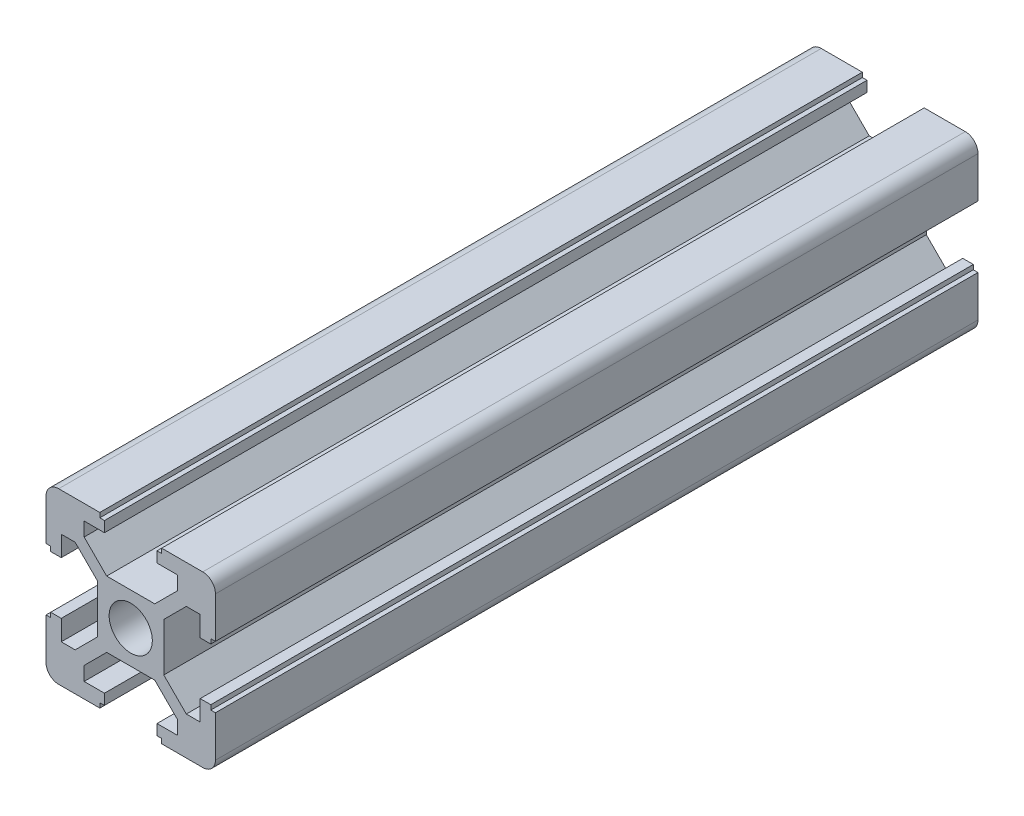
from build123d import *

# Parameters (mm, degrees)
BOSS_EXTRUDE1_DEPTH = 90
SKETCH3_R           = 2.55
CUT_EXTRUDE1_DEPTH  = 92.104335791
FILLET1_R           = 1.5


with BuildPart() as part:
    # Sketch2 → Boss-Extrude1 (new body)
    with BuildSketch(Plane.XY):
        Polygon((-10, 10), (-3.65, 10), (-3.65, 9.45), (-3.1, 9.45), (-3.1, 8.2), (-5.5, 8.2), (-5.5, 6.560660172), (-2.839339828, 3.9), (0, 3.9), (2.839339828, 3.9), (5.5, 6.560660172), (5.5, 8.2), (3.1, 8.2), (3.1, 9.45), (3.65, 9.45), (3.65, 10), (10, 10), (10, 3.65), (9.45, 3.65), (9.45, 3.1), (8.2, 3.1), (8.2, 5.5), (6.560660172, 5.5), (3.9, 2.839339828), (3.9, 0), (3.9, -2.839339828), (6.560660172, -5.5), (8.2, -5.5), (8.2, -3.1), (9.45, -3.1), (9.45, -3.65), (10, -3.65), (10, -10), (3.65, -10), (3.65, -9.45), (3.1, -9.45), (3.1, -8.2), (5.5, -8.2), (5.5, -6.560660172), (2.839339828, -3.9), (0, -3.9), (-2.839339828, -3.9), (-5.5, -6.560660172), (-5.5, -8.2), (-3.1, -8.2), (-3.1, -9.45), (-3.65, -9.45), (-3.65, -10), (-10, -10), (-10, -3.65), (-9.45, -3.65), (-9.45, -3.1), (-8.2, -3.1), (-8.2, -5.5), (-6.560660172, -5.5), (-3.9, -2.839339828), (-3.9, 0), (-3.9, 2.839339828), (-6.560660172, 5.5), (-8.2, 5.5), (-8.2, 3.1), (-9.45, 3.1), (-9.45, 3.65), (-10, 3.65), align=None)
    extrude(amount=-BOSS_EXTRUDE1_DEPTH)

    # Sketch3 → Cut-Extrude1 (cut, through all)
    with BuildSketch(Plane.XY):
        Circle(SKETCH3_R)
    extrude(amount=-CUT_EXTRUDE1_DEPTH, mode=Mode.SUBTRACT)

    # Fillet1
    fillet1_edges = [part.edges().sort_by_distance(p)[0] for p in [
        (10, 10, -45),
        (10, -10, -45),
        (-10, -10, -45),
        (-10, 10, -45),
    ]]
    fillet(fillet1_edges, radius=FILLET1_R)


solid = part.part
